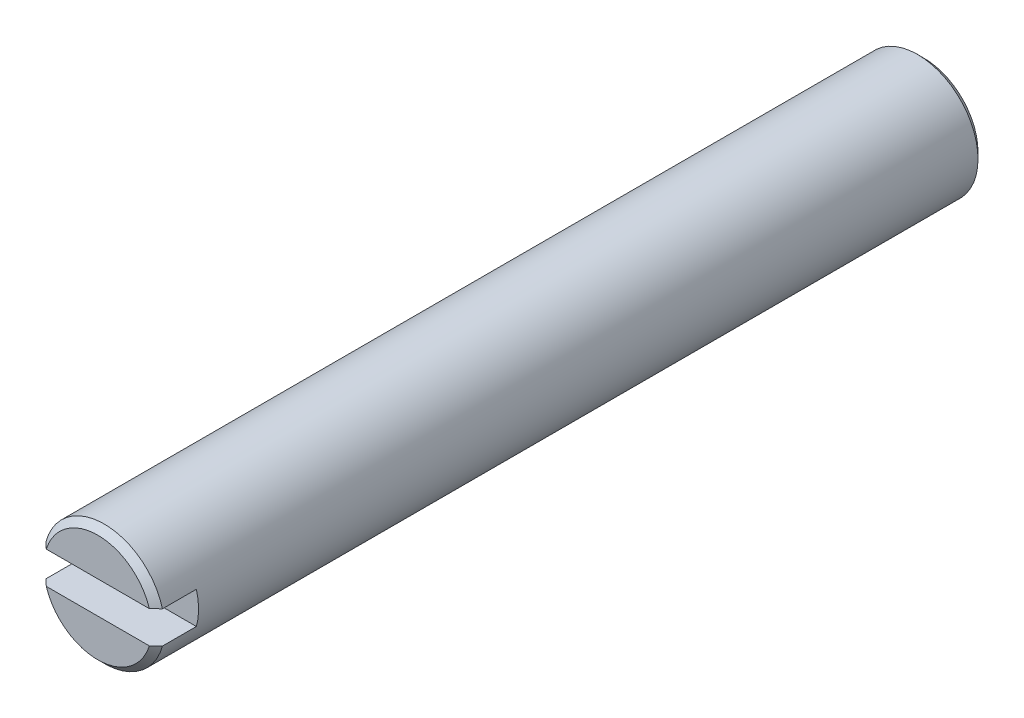
from build123d import *

# Parameters (mm, degrees)
SKETCH1_R           = 0.1875
BOSS_EXTRUDE1_DEPTH = 2.563
CUT_EXTRUDE1_START  = -0.125
CUT_EXTRUDE1_DEPTH  = 0.125
CHAMFER1_SIZE       = 0.02
CHAMFER2_SIZE       = 0.02
CHAMFER3_SIZE       = 0.02


with BuildPart() as part:
    # Sketch1 → Boss-Extrude1 (new body)
    with BuildSketch(Plane.XY):
        Circle(SKETCH1_R)
    extrude(amount=BOSS_EXTRUDE1_DEPTH)

    # Sketch2 → Cut-Extrude1 (cut)
    with BuildSketch(Plane.XY.offset(2.563).offset(CUT_EXTRUDE1_START)):
        with BuildLine():
            Line((0.180710404, 0.05), (-0.180710404, 0.05))
            ThreePointArc((-0.180710404, 0.05), (-0.1875, 0), (-0.180710404, -0.05))
            Line((-0.180710404, -0.05), (0.180710404, -0.05))
            ThreePointArc((0.180710404, -0.05), (0.185794847, -0.02522944), (0.1875, 0))
            ThreePointArc((0.1875, 0), (0.185794847, 0.02522944), (0.180710404, 0.05))
        make_face()
    extrude(amount=CUT_EXTRUDE1_DEPTH, mode=Mode.SUBTRACT)

    # Chamfer1
    chamfer1_edges = [part.edges().sort_by_distance(p)[0] for p in [
        (0, 0.1875, 2.563),
    ]]
    chamfer(chamfer1_edges, length=CHAMFER1_SIZE)

    # Chamfer2
    chamfer2_edges = [part.edges().sort_by_distance(p)[0] for p in [
        (0, -0.1875, 2.563),
    ]]
    chamfer(chamfer2_edges, length=CHAMFER2_SIZE)

    # Chamfer3
    chamfer3_edges = [part.edges().sort_by_distance(p)[0] for p in [
        (-0.1875, 0, 0),
    ]]
    chamfer(chamfer3_edges, length=CHAMFER3_SIZE)


solid = part.part
